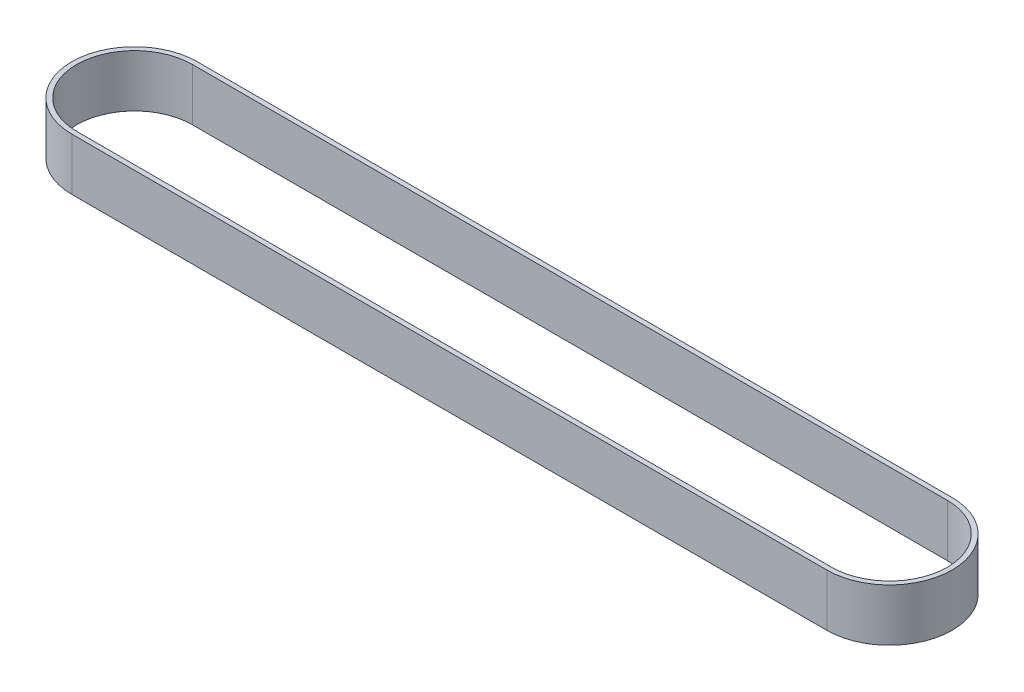
from build123d import *

# Parameters (mm, degrees)
EXTRUDE_1_DEPTH = 10


with BuildPart() as part:
    # 草图1 → 凸台-拉伸1 (new body)
    with BuildSketch(Plane(origin=(0, 0, 0), x_dir=(1, 0, 0), z_dir=(0, 1, 0))):
        with BuildLine():
            ThreePointArc((156.5, 0), (152.985281374, 8.485281374), (144.5, 12))
            Line((144.5, 12), (144.5, 11.08))
            ThreePointArc((144.5, 11.08), (152.334743136, 7.834743136), (155.58, 0))
            ThreePointArc((155.58, 0), (152.334743136, -7.834743136), (144.5, -11.08))
            Line((144.5, -11.08), (144.5, -12))
            ThreePointArc((144.5, -12), (152.985281374, -8.485281374), (156.5, 0))
        make_face()
        with BuildLine():
            ThreePointArc((144.5, 12), (142.150531975, 11.767752547), (139.892006944, 11.08))
            Line((139.892006944, 11.08), (144.5, 11.08))
            Line((144.5, 11.08), (144.5, 12))
        make_face()
        with BuildLine():
            ThreePointArc((0, 12), (2.349468025, 11.767752547), (4.607993056, 11.08))
            Line((4.607993056, 11.08), (139.892006944, 11.08))
            ThreePointArc((139.892006944, 11.08), (142.150531975, 11.767752547), (144.5, 12))
            Line((144.5, 12), (0, 12))
        make_face()
        with BuildLine():
            Line((144.5, -11.08), (139.892006944, -11.08))
            ThreePointArc((139.892006944, -11.08), (142.150531975, -11.767752547), (144.5, -12))
            Line((144.5, -12), (144.5, -11.08))
        make_face()
        with BuildLine():
            Line((139.892006944, -11.08), (4.607993056, -11.08))
            ThreePointArc((4.607993056, -11.08), (2.349468025, -11.767752547), (0, -12))
            Line((0, -12), (144.5, -12))
            ThreePointArc((144.5, -12), (142.150531975, -11.767752547), (139.892006944, -11.08))
        make_face()
        with BuildLine():
            Line((0, 12), (0, 11.08))
            Line((0, 11.08), (4.607993056, 11.08))
            ThreePointArc((4.607993056, 11.08), (2.349468025, 11.767752547), (0, 12))
        make_face()
        with BuildLine():
            Line((4.607993056, -11.08), (0, -11.08))
            Line((0, -11.08), (0, -12))
            ThreePointArc((0, -12), (2.349468025, -11.767752547), (4.607993056, -11.08))
        make_face()
        with BuildLine():
            ThreePointArc((0, -11.08), (-11.08, 0), (0, 11.08))
            Line((0, 11.08), (0, 12))
            ThreePointArc((0, 12), (-12, 0), (0, -12))
            Line((0, -12), (0, -11.08))
        make_face()
    extrude(amount=EXTRUDE_1_DEPTH)


solid = part.part
